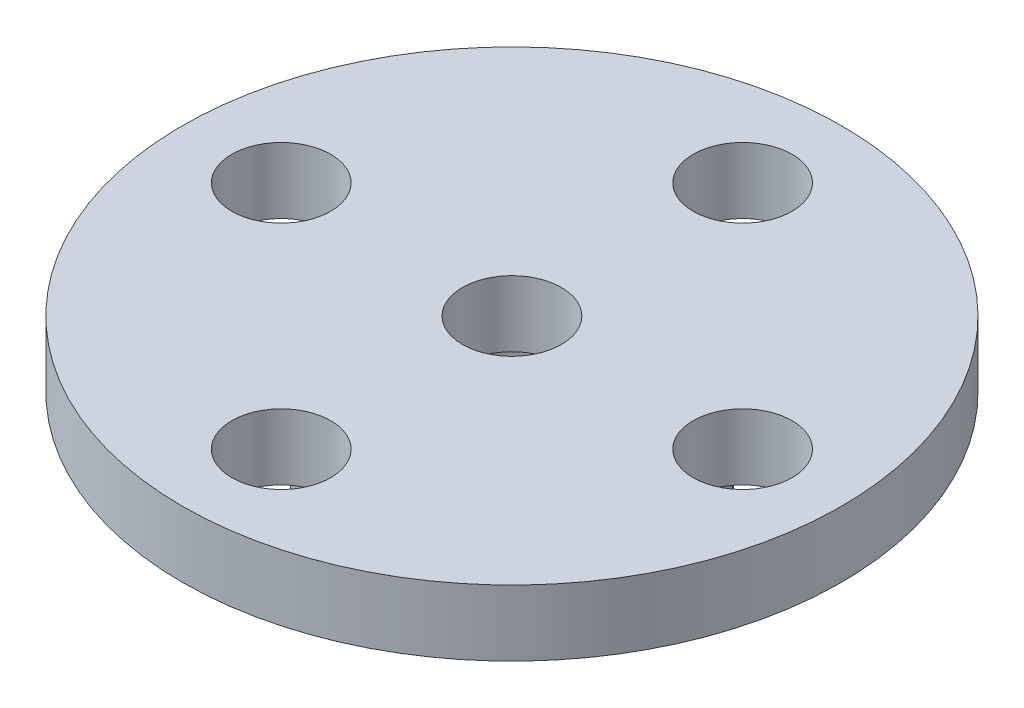
from build123d import *

# Parameters (mm, degrees)
SKETCH1_R           = 10
SKETCH1_R_2         = 1.5
BOSS_EXTRUDE1_DEPTH = 2
SKETCH1_3_R         = 4.75
SKETCH1_3_R_2       = 2.9
BOSS_EXTRUDE2_DEPTH = 3


with BuildPart() as part:
    # Sketch1 → Boss-Extrude1 (new body)
    with BuildSketch(Plane(origin=(0, 0, 0), x_dir=(1, 0, 0), z_dir=(0, 1, 0))):
        Circle(SKETCH1_R)
        with Locations((0, -7)):
            Circle(SKETCH1_R_2, mode=Mode.SUBTRACT)
        with Locations((7, 0)):
            Circle(SKETCH1_R_2, mode=Mode.SUBTRACT)
        with Locations((-7, 0)):
            Circle(SKETCH1_R_2, mode=Mode.SUBTRACT)
        with Locations((0, 7)):
            Circle(SKETCH1_R_2, mode=Mode.SUBTRACT)
        Circle(SKETCH1_R_2, mode=Mode.SUBTRACT)
    extrude(amount=BOSS_EXTRUDE1_DEPTH)

    # Sketch1<3> → Boss-Extrude2 (add)
    with BuildSketch(Plane(origin=(0, 0, 0), x_dir=(1, 0, 0), z_dir=(0, 1, 0))):
        Circle(SKETCH1_3_R)
        Circle(SKETCH1_3_R_2, mode=Mode.SUBTRACT)
    extrude(amount=-BOSS_EXTRUDE2_DEPTH)


solid = part.part
